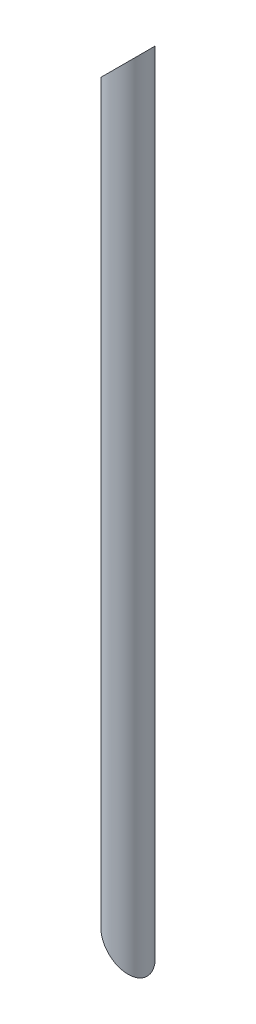
from build123d import *

# Parameters (mm, degrees)
ESBO_O2_W                  = 39.3
ESBO_O2_H                  = 1640
CORTE_EXTRUS_O1_DEPTH      = 1641.941491949
CORTE_EXTRUS_O1_DEPTH_BACK = 1641.941491949
ESBO_O9_R                  = 35.87378144
CORTE_EXTRUS_O6_DEPTH      = 1641.941491949


with BuildPart() as part:
    # Esboço2 → Revolução2 (revolve)
    with BuildSketch(Plane.XY):
        with Locations((19.65, 820)):
            Rectangle(ESBO_O2_W, ESBO_O2_H)
    revolve(axis=Axis((0, 0, 0), (0, 1, 0)))

    # Esboço3 → Corte-extrusão1 (cut, two sides: drawn at the far end of the back side and taken through both)
    with BuildSketch(Plane.XY.offset(-CORTE_EXTRUS_O1_DEPTH_BACK)):
        Polygon((-39.3, 1640), (39.3, 1640), (-39.3, 1561.4), align=None)
        Polygon((39.3, 0), (-39.3, 78.6), (-39.3, 0), align=None)
    extrude(amount=CORTE_EXTRUS_O1_DEPTH + CORTE_EXTRUS_O1_DEPTH_BACK, mode=Mode.SUBTRACT)

    # Esboço9 → Corte-extrusão6 (cut, through all)
    with BuildSketch(Plane(origin=(0, 0, 0), x_dir=(1, 0, 0), z_dir=(0, 1, 0))):
        Circle(ESBO_O9_R)
    extrude(amount=CORTE_EXTRUS_O6_DEPTH, mode=Mode.SUBTRACT)


solid = part.part
